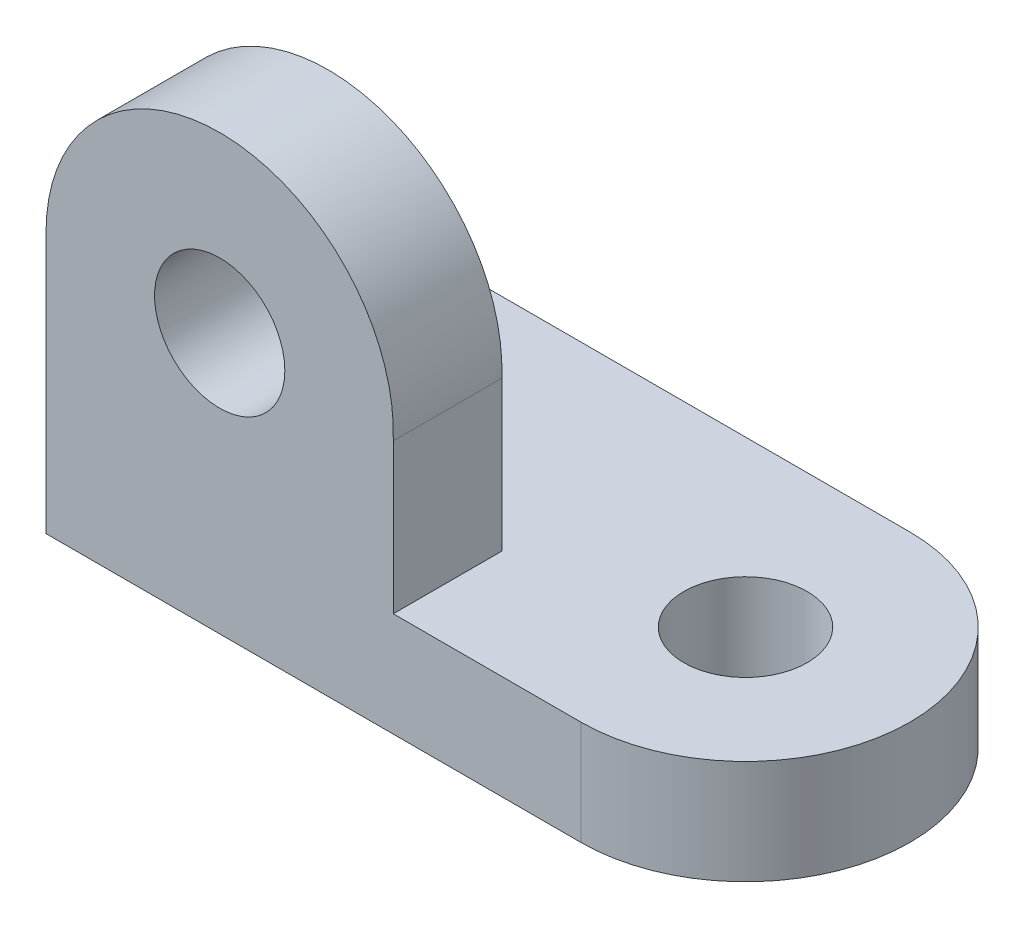
from build123d import *

# Parameters (mm, degrees)
SKETCH2_R           = 14.213072664
BOSS_EXTRUDE2_DEPTH = 24
SKETCH4_R           = 15
BOSS_EXTRUDE4_DEPTH = 25
FILLET2_R           = 20


with BuildPart() as part:
    # Sketch2 → Boss-Extrude2 (new body)
    with BuildSketch(Plane(origin=(0, 0, 0), x_dir=(1, 0, 0), z_dir=(0, 1, 0))):
        with BuildLine():
            Line((0, 0), (0, 75.803054209))
            Line((0, 75.803054209), (123.17996309, 75.803054209))
            ThreePointArc((123.17996309, 75.803054209), (161.081490195, 37.901527105), (123.17996309, 0))
            Line((123.17996309, 0), (0, 0))
        make_face()
        with Locations(Location((123.17996309, 37.901527105, 0), (0, 0, 270))):
            Circle(SKETCH2_R, mode=Mode.SUBTRACT)
    extrude(amount=BOSS_EXTRUDE2_DEPTH)

    # Sketch4 → Boss-Extrude4 (add)
    with BuildSketch(Plane.XY):
        with BuildLine():
            Line((0, 60), (0, 24))
            Line((0, 24), (79.971353362, 24))
            Line((79.971353362, 24), (79.971353362, 58.486424634))
            ThreePointArc((79.971353362, 58.486424634), (40.756923216, 99.992837699), (0, 60))
        make_face()
        with Locations((40, 60)):
            Circle(SKETCH4_R, mode=Mode.SUBTRACT)
    extrude(amount=-BOSS_EXTRUDE4_DEPTH)

    # Fillet2
    fillet2_edges = [part.edges().sort_by_distance(p)[0] for p in [
        (0, 12, -75.803054209),
    ]]
    fillet(fillet2_edges, radius=FILLET2_R)


solid = part.part
